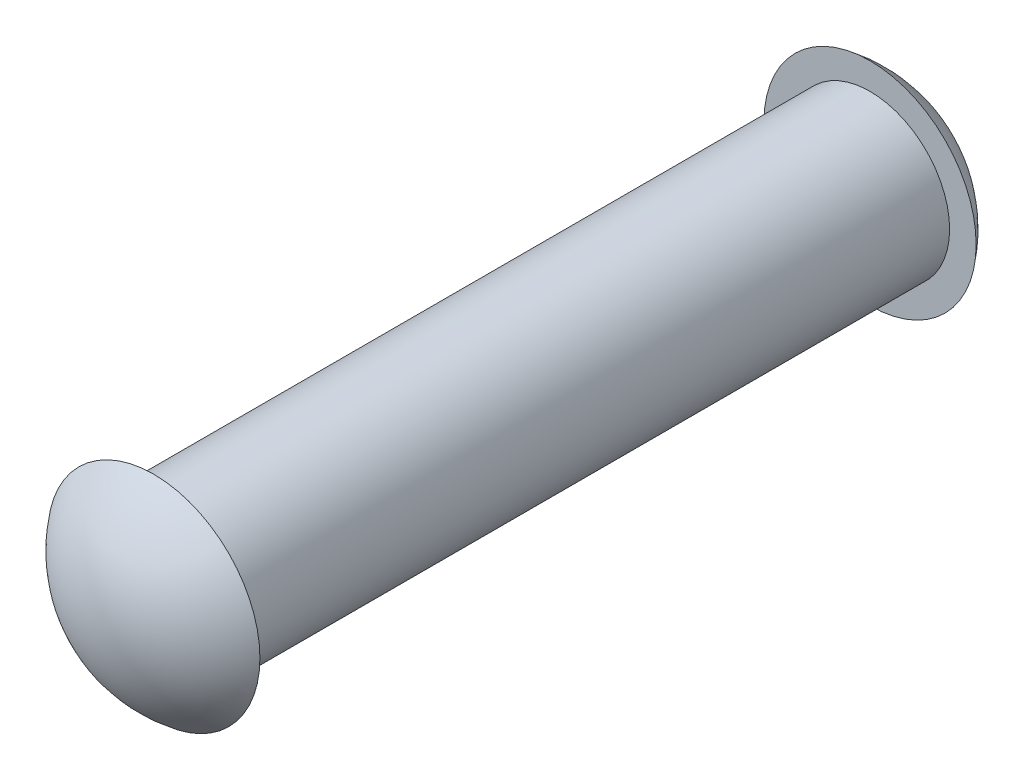
from build123d import *

# Parameters (mm, degrees)
CROQUIS1_R              = 3
SALIENTE_EXTRUIR1_DEPTH = 27


with BuildPart() as part:
    # Croquis1 → Saliente-Extruir1 (new body)
    with BuildSketch(Plane.XY):
        with Locations((-23.169872981, 0)):
            Circle(CROQUIS1_R)
    extrude(amount=-SALIENTE_EXTRUIR1_DEPTH)

    # Croquis2 → Revolución1 (revolve)
    with BuildSketch(Plane(origin=(0, 0, 0), x_dir=(1, 0, 0), z_dir=(0, 1, 0))):
        with BuildLine():
            Line((-23.169872981, 0), (-23.169872981, -2))
            ThreePointArc((-23.169872981, -2), (-20.933805004, -1.472135955), (-19.169872981, 0))
            Line((-19.169872981, 0), (-23.169872981, 0))
        make_face()
    revoluci_n1 = revolve(axis=Axis((-23.169872981, 0, 0), (0, 0, 1)))

    # Simetría1: Revolución1 across plane
    add(revoluci_n1.mirror(Plane.XY.offset(-13.5)))


solid = part.part
